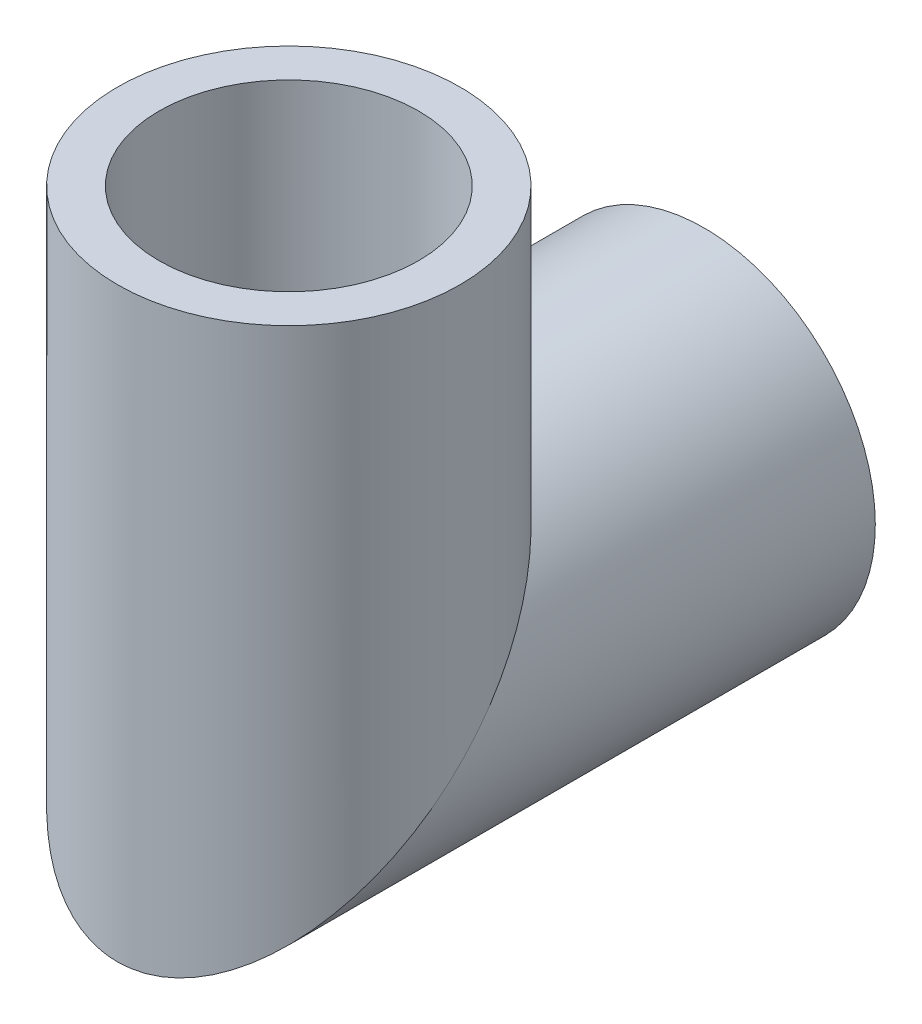
from build123d import *

# Parameters (mm, degrees)
SKETCH_1_R = 16.5
SKETCH_3_R = 12.5


with BuildPart() as part:
    # Sweep 1: sweep along a path in 草图2
    with BuildLine(Plane(origin=(0, 0, 0), x_dir=(0, 0, -1), z_dir=(1, 0, 0))) as sweep_1_path:
        Line((0, 0), (-40, 0))
        Line((-40, 0), (-40, 40))
    # 草图1 → Sweep 1 (sweep)
    with BuildSketch(Plane.XY):
        Circle(SKETCH_1_R)
    sweep(path=sweep_1_path.line, transition=Transition.RIGHT)

    # Sweep 1 2: sweep along a path in 草图4
    with BuildLine(Plane(origin=(0, 0, 0), x_dir=(0, 0, -1), z_dir=(1, 0, 0))) as sweep_1_2_path:
        Line((0, 0), (-40, 0))
        Line((-40, 0), (-40, 40))
    # 草图3 → Sweep 1 2 (sweep, cut)
    with BuildSketch(Plane(origin=(0, 0, 0), x_dir=(-1, 0, 0), z_dir=(0, 0, -1))):
        Circle(SKETCH_3_R)
    sweep(path=sweep_1_2_path.line, transition=Transition.RIGHT, mode=Mode.SUBTRACT)


solid = part.part
